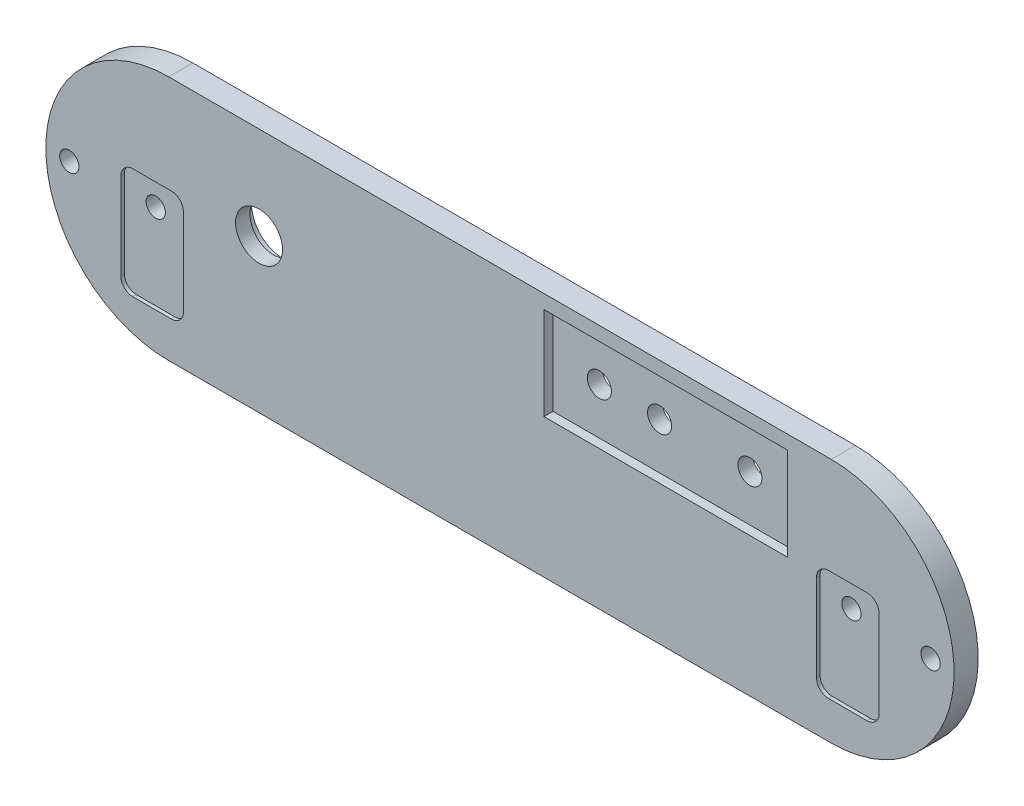
from build123d import *

# Parameters (mm, degrees)
BOSS_EXTRU_1_DEPTH      = 4
ESQUISSE6_R             = 1.6
ENL_V_MAT_EXTRU_3_DEPTH = 79.213298102
ENL_V_MAT_EXTRU_4_DEPTH = 0.6
ESQUISSE8_W             = 40.4
ESQUISSE8_H             = 15.4
ENL_V_MAT_EXTRU_5_DEPTH = 1.5
ESQUISSE8_3_R           = 2
ENL_V_MAT_EXTRU_6_DEPTH = 79.213298102
ESQUISSE9_R             = 5.25
ENL_V_MAT_EXTRU_7_DEPTH = 1.6
ESQUISSE9_3_R           = 3.9
ENL_V_MAT_EXTRU_8_DEPTH = 79.213298102
ENL_V_MAT_EXTRU_9_DEPTH = 0.8


with BuildPart() as part:
    # Esquisse1 → Boss.-Extru.1 (new body)
    with BuildSketch(Plane.XY):
        with BuildLine():
            Line((-55, 20.4), (55, 20.4))
            ThreePointArc((55, 20.4), (75.4, 0), (55, -20.4))
            Line((55, -20.4), (-55, -20.4))
            ThreePointArc((-55, -20.4), (-75.4, 0), (-55, 20.4))
        make_face()
    extrude(amount=BOSS_EXTRU_1_DEPTH)

    # Esquisse6 → Enlèv. mat.-Extru.3 (cut, through all)
    with BuildSketch(Plane.XY.offset(4)):
        with Locations((-57.75, 0)):
            Circle(ESQUISSE6_R)
        with Locations((57.75, 0)):
            Circle(ESQUISSE6_R)
        with Locations((71.5, 0)):
            Circle(ESQUISSE6_R)
        with Locations((-71.5, 0)):
            Circle(ESQUISSE6_R)
    extrude(amount=-ENL_V_MAT_EXTRU_3_DEPTH, mode=Mode.SUBTRACT)

    # Esquisse7 → Enlèv. mat.-Extru.4 (cut)
    with BuildSketch(Plane.XY.offset(4)):
        with BuildLine():
            Line((-60.95, 4.2), (-54.55, 4.2))
            ThreePointArc((-54.55, 4.2), (-53.135786438, 3.614213562), (-52.55, 2.2))
            Line((-52.55, 2.2), (-52.55, -12.2))
            ThreePointArc((-52.55, -12.2), (-53.135786438, -13.614213562), (-54.55, -14.2))
            Line((-54.55, -14.2), (-60.95, -14.2))
            ThreePointArc((-60.95, -14.2), (-62.364213562, -13.614213562), (-62.95, -12.2))
            Line((-62.95, -12.2), (-62.95, 2.2))
            ThreePointArc((-62.95, 2.2), (-62.364213562, 3.614213562), (-60.95, 4.2))
        make_face()
        with BuildLine():
            Line((60.95, 4.2), (54.55, 4.2))
            ThreePointArc((54.55, 4.2), (53.135786438, 3.614213562), (52.55, 2.2))
            Line((52.55, 2.2), (52.55, -12.2))
            ThreePointArc((52.55, -12.2), (53.135786438, -13.614213562), (54.55, -14.2))
            Line((54.55, -14.2), (60.95, -14.2))
            ThreePointArc((60.95, -14.2), (62.364213562, -13.614213562), (62.95, -12.2))
            Line((62.95, -12.2), (62.95, 2.2))
            ThreePointArc((62.95, 2.2), (62.364213562, 3.614213562), (60.95, 4.2))
        make_face()
    extrude(amount=-ENL_V_MAT_EXTRU_4_DEPTH, mode=Mode.SUBTRACT)

    # Esquisse8 → Enlèv. mat.-Extru.5 (cut)
    with BuildSketch(Plane.XY.offset(4)):
        with Locations((27.5, 10.4)):
            Rectangle(ESQUISSE8_W, ESQUISSE8_H)
    extrude(amount=-ENL_V_MAT_EXTRU_5_DEPTH, mode=Mode.SUBTRACT)

    # Esquisse8<3> → Enlèv. mat.-Extru.6 (cut, through all)
    with BuildSketch(Plane.XY.offset(4)):
        with Locations((25, 10.4)):
            Circle(ESQUISSE8_3_R)
        with Locations((15, 10.4)):
            Circle(ESQUISSE8_3_R)
        with Locations((40, 10.4)):
            Circle(ESQUISSE8_3_R)
    extrude(amount=-ENL_V_MAT_EXTRU_6_DEPTH, mode=Mode.SUBTRACT)

    # Esquisse9 → Enlèv. mat.-Extru.7 (cut)
    with BuildSketch(Plane(origin=(0, 0, 0), x_dir=(-1, 0, 0), z_dir=(0, 0, -1))):
        with Locations((40, 5)):
            Circle(ESQUISSE9_R)
    extrude(amount=-ENL_V_MAT_EXTRU_7_DEPTH, mode=Mode.SUBTRACT)

    # Esquisse9<3> → Enlèv. mat.-Extru.8 (cut, through all)
    with BuildSketch(Plane(origin=(0, 0, 0), x_dir=(-1, 0, 0), z_dir=(0, 0, -1))):
        with Locations((40, 5)):
            Circle(ESQUISSE9_3_R)
    extrude(amount=-ENL_V_MAT_EXTRU_8_DEPTH, mode=Mode.SUBTRACT)

    # Esquisse10 → Enlèv. mat.-Extru.9 (cut)
    # profile 1 of 24: a face of its own
    with BuildSketch(Plane(origin=(0, 0, 0), x_dir=(-1, 0, 0), z_dir=(0, 0, -1))):
        Polygon((-7.488648481, 5.760557012), (-8.969364037, 4.279841456), (-10.748001341, 6.05847876), (-11.935241742, 6.054032167), (-13.415957298, 4.573316611), (-12.824560394, 3.981919707), (-11.343844838, 5.462635263), (-9.565207534, 3.683997959), (-11.04592309, 2.203282403), (-10.454526186, 1.611885499), (-6.897251577, 5.169160108), align=None)
    # profile 2 of 24: a face of its own
    with BuildSketch(Plane(origin=(0, 0, 0), x_dir=(-1, 0, 0), z_dir=(0, 0, -1))):
        with BuildLine():
            add(Edge.make_bspline(
                [(-4.333511639, 2.605420169), (-4.395801516, 2.664370533), (-4.518579187, 2.780565791), (-4.720441779, 2.929233561), (-4.929305204, 3.057152317), (-5.148225769, 3.160758872), (-5.376591038, 3.239741397), (-5.613852534, 3.296543436), (-5.860218715, 3.330129513), (-6.027580235, 3.332739717), (-6.112291092, 3.334060885)],
                knots=[0, 0, 0, 0, 1.040882578, 2.051651826, 3.038415913, 4.012224473, 4.98727928, 5.968271899, 6.971630815, 8, 8, 8, 8], degree=3))
            add(Edge.make_bspline(
                [(-6.112291092, 3.334060885), (-6.19762286, 3.332106965), (-6.365937526, 3.328252909), (-6.613593771, 3.293356161), (-6.852003627, 3.237882317), (-7.079821121, 3.15646041), (-7.298854176, 3.054506325), (-7.507825264, 2.928024444), (-7.707240779, 2.7786502), (-7.829149413, 2.6635903), (-7.890857322, 2.605349095)],
                knots=[0, 0, 0, 0, 1.036475983, 2.044421605, 3.033015538, 4.006241789, 4.978909718, 5.964201219, 6.969516094, 8, 8, 8, 8], degree=3))
            add(Edge.make_bspline(
                [(-7.890857322, 2.605349095), (-7.949486002, 2.543399758), (-8.065190747, 2.42114164), (-8.214005944, 2.220309132), (-8.342015139, 2.011832276), (-8.44394129, 1.79222433), (-8.524911413, 1.564282733), (-8.580672833, 1.326286966), (-8.615803142, 1.079541473), (-8.618905897, 0.911813835), (-8.620478865, 0.826782865)],
                knots=[0, 0, 0, 0, 1.035370356, 2.043321829, 3.030216223, 4.002584397, 4.978984985, 5.963690331, 6.967675283, 8, 8, 8, 8], degree=3))
            add(Edge.make_bspline(
                [(-8.620478865, 0.826782865), (-8.618921942, 0.741446512), (-8.615856218, 0.573411392), (-8.580631551, 0.326384573), (-8.525128124, 0.088594959), (-8.443497313, -0.139081154), (-8.342305957, -0.359007033), (-8.213965693, -0.567635283), (-8.065201221, -0.768490313), (-7.949489525, -0.890745345), (-7.890857322, -0.952693118)],
                knots=[0, 0, 0, 0, 1.03554716, 2.03908753, 3.023356833, 3.99585233, 4.971125606, 5.957582987, 6.965088123, 8, 8, 8, 8], degree=3))
            add(Edge.make_bspline(
                [(-7.890857322, -0.952693118), (-7.828890959, -1.011291623), (-7.70659924, -1.126936815), (-7.50613813, -1.276092664), (-7.296794088, -1.402505257), (-7.078441273, -1.506104127), (-6.85021501, -1.585654207), (-6.612734805, -1.641673347), (-6.365650692, -1.676752003), (-6.197623445, -1.679837794), (-6.112291092, -1.681404908)],
                knots=[0, 0, 0, 0, 1.035545361, 2.043667206, 3.02882155, 4.002923329, 4.974792527, 5.959664315, 6.963818967, 8, 8, 8, 8], degree=3))
            add(Edge.make_bspline(
                [(-6.112291092, -1.681404908), (-6.026981179, -1.680394625), (-5.858756481, -1.678402423), (-5.611162229, -1.645738292), (-5.373066837, -1.589705576), (-5.143652097, -1.512261536), (-4.924995082, -1.407529232), (-4.714611576, -1.281986806), (-4.514313349, -1.131100231), (-4.391495604, -1.015161249), (-4.329176099, -0.956332128)],
                knots=[0, 0, 0, 0, 1.033605604, 2.038192105, 3.020018283, 3.995463696, 4.967390178, 5.953495233, 6.96157381, 8, 8, 8, 8], degree=3))
            add(Edge.make_bspline(
                [(-4.329176099, -0.956332128), (-4.270542293, -0.894705313), (-4.154969687, -0.773233215), (-4.006382942, -0.573281028), (-3.881179651, -0.363605092), (-3.777272612, -0.145021817), (-3.699300004, 0.084539031), (-3.642496042, 0.322888269), (-3.608875514, 0.571685216), (-3.606314036, 0.7408598), (-3.605013072, 0.826782865)],
                knots=[0, 0, 0, 0, 1.03108762, 2.032368184, 3.013975279, 3.9897687, 4.962277092, 5.949074184, 6.95834334, 8, 8, 8, 8], degree=3))
            add(Edge.make_bspline(
                [(-3.605013072, 0.826782865), (-3.606595275, 0.911810285), (-3.609716246, 1.07953092), (-3.644713654, 1.326327504), (-3.700943381, 1.564036757), (-3.780096601, 1.792706413), (-3.883938262, 2.011277044), (-4.010318301, 2.220632324), (-4.159482991, 2.421090382), (-4.275126971, 2.54338252), (-4.333511639, 2.605420169)],
                knots=[0, 0, 0, 0, 1.03252536, 2.036705445, 3.021602178, 3.996975283, 4.971101734, 5.956281031, 6.96442841, 8, 8, 8, 8], degree=3))
        make_face()
        with BuildLine():
            add(Edge.make_bspline(
                [(-4.929355136, 2.009576672), (-4.890388331, 1.968419852), (-4.813575469, 1.887289945), (-4.714264897, 1.754386386), (-4.630131699, 1.615762744), (-4.561046189, 1.470424314), (-4.507509614, 1.318553365), (-4.469179147, 1.160077314), (-4.446045244, 0.995464392), (-4.442748538, 0.883564935), (-4.441075663, 0.826782865)],
                knots=[0, 0, 0, 0, 1.034154483, 2.038565042, 3.022343384, 3.990746911, 4.971435185, 5.957159338, 6.963384414, 8, 8, 8, 8], degree=3))
            add(Edge.make_bspline(
                [(-4.441075663, 0.826782865), (-4.442762719, 0.770001728), (-4.4460963, 0.657803685), (-4.469116625, 0.492882647), (-4.507299176, 0.334323986), (-4.56149176, 0.182722563), (-4.629838311, 0.037058206), (-4.714318424, -0.10170021), (-4.813531812, -0.234708633), (-4.890537942, -0.315705407), (-4.929612781, -0.356805199)],
                knots=[0, 0, 0, 0, 1.035863614, 2.046839418, 3.031848518, 4.00661017, 4.979312524, 5.962377223, 6.966059173, 8, 8, 8, 8], degree=3))
            add(Edge.make_bspline(
                [(-4.929612781, -0.356805199), (-4.970469296, -0.395791088), (-5.051101359, -0.47273139), (-5.182675476, -0.573428284), (-5.321946664, -0.65724007), (-5.467467175, -0.726987924), (-5.620087016, -0.781975364), (-5.7798986, -0.820763846), (-5.946270503, -0.84517901), (-6.059440762, -0.848305399), (-6.116839855, -0.84989108)],
                knots=[0, 0, 0, 0, 1.025546179, 2.023958797, 3.002904201, 3.973894049, 4.951613763, 5.944507637, 6.95746995, 8, 8, 8, 8], degree=3))
            add(Edge.make_bspline(
                [(-6.116839855, -0.84989108), (-6.173636741, -0.848326329), (-6.285307707, -0.845249799), (-6.449527942, -0.820638036), (-6.607286363, -0.782049767), (-6.75845289, -0.726533401), (-6.90342067, -0.657550309), (-7.04202192, -0.573115093), (-7.173504572, -0.472771847), (-7.254120874, -0.395804694), (-7.294969404, -0.356805199)],
                knots=[0, 0, 0, 0, 1.038420532, 2.041686296, 3.030450046, 4.004274774, 4.981757309, 5.96250766, 6.967596333, 8, 8, 8, 8], degree=3))
            add(Edge.make_bspline(
                [(-7.294969404, -0.356805199), (-7.334358802, -0.315718336), (-7.411973648, -0.234758718), (-7.511976361, -0.101482063), (-7.598320934, 0.036980975), (-7.66867125, 0.182473533), (-7.723668312, 0.334291485), (-7.762461174, 0.492917943), (-7.78789689, 0.657671824), (-7.791627176, 0.769981356), (-7.793513799, 0.826782865)],
                knots=[0, 0, 0, 0, 1.034748449, 2.038920251, 3.024967065, 3.999680523, 4.973550384, 5.957093399, 6.966782462, 8, 8, 8, 8], degree=3))
            add(Edge.make_bspline(
                [(-7.793513799, 0.826782865), (-7.791642593, 0.883585639), (-7.787952673, 0.995597685), (-7.762394305, 1.16004067), (-7.723456406, 1.318583639), (-7.669122376, 1.470679605), (-7.598026509, 1.615837419), (-7.512017401, 1.754157025), (-7.411962942, 1.887409743), (-7.334355198, 1.968372646), (-7.294969404, 2.009461176)],
                knots=[0, 0, 0, 0, 1.033893284, 2.038782502, 3.022968775, 4.002669564, 4.973054543, 5.959746252, 6.964574803, 8, 8, 8, 8], degree=3))
            add(Edge.make_bspline(
                [(-7.294969404, 2.009461176), (-7.254117003, 2.048452149), (-7.173493061, 2.125402485), (-7.042066096, 2.22586832), (-6.903146921, 2.309919788), (-6.758904884, 2.380573055), (-6.60704483, 2.434362429), (-6.449566514, 2.473394306), (-6.285297608, 2.497879518), (-6.173633336, 2.500973453), (-6.116839855, 2.502547057)],
                knots=[0, 0, 0, 0, 1.032336146, 2.037359086, 3.018045294, 3.997868532, 4.969748149, 5.958447233, 6.961647382, 8, 8, 8, 8], degree=3))
            add(Edge.make_bspline(
                [(-6.116839855, 2.502547057), (-6.05944416, 2.500952465), (-5.946280601, 2.497808507), (-5.779859865, 2.473521406), (-5.620327221, 2.434285206), (-5.467016844, 2.38102873), (-5.322220642, 2.309608613), (-5.182631484, 2.226181272), (-5.051112799, 2.12536214), (-4.970473143, 2.048438581), (-4.929355136, 2.009576672)],
                knots=[0, 0, 0, 0, 1.042459734, 2.055353725, 3.04818063, 4.023985327, 4.997298338, 5.976177714, 6.974522992, 8, 8, 8, 8], degree=3))
        make_face(mode=Mode.SUBTRACT)
    # profile 3 of 24: a face of its own
    with BuildSketch(Plane(origin=(0, 0, 0), x_dir=(-1, 0, 0), z_dir=(0, 0, -1))):
        with BuildLine():
            add(Edge.make_bspline(
                [(-1.413408834, -4.467800741), (-1.444364247, -4.496429084), (-1.505258253, -4.552745388), (-1.60430696, -4.626148752), (-1.708753465, -4.687440378), (-1.818266046, -4.737462427), (-1.932391774, -4.777074102), (-2.051710821, -4.804068541), (-2.175670497, -4.820916952), (-2.260100956, -4.82291842), (-2.302914056, -4.823933326)],
                knots=[0, 0, 0, 0, 1.027936133, 2.022106722, 3.000214623, 3.976642886, 4.95444307, 5.941322166, 6.956083143, 8, 8, 8, 8], degree=3))
            add(Edge.make_bspline(
                [(-2.302914056, -4.823933326), (-2.345739389, -4.823019967), (-2.429934363, -4.821224294), (-2.553533594, -4.802995306), (-2.672584457, -4.775286663), (-2.786653053, -4.734649653), (-2.896480544, -4.683947877), (-3.00075012, -4.620313375), (-3.10043631, -4.545666176), (-3.161634276, -4.488232448), (-3.192652048, -4.459122555)],
                knots=[0, 0, 0, 0, 1.039723389, 2.044105151, 3.02870267, 4.00499634, 4.980594832, 5.962321637, 6.967216646, 8, 8, 8, 8], degree=3))
            add(Edge.make_bspline(
                [(-3.192652048, -4.459122555), (-3.222484487, -4.428205761), (-3.281067165, -4.36749371), (-3.355502271, -4.266912596), (-3.420239584, -4.163032305), (-3.471924753, -4.052903056), (-3.513556981, -3.938299675), (-3.541015079, -3.818157732), (-3.559316722, -3.693676441), (-3.561103055, -3.608875316), (-3.562011582, -3.565745554)],
                knots=[0, 0, 0, 0, 1.036483605, 2.035367747, 3.015034268, 3.987916637, 4.967720004, 5.953552987, 6.959179192, 8, 8, 8, 8], degree=3))
            add(Edge.make_bspline(
                [(-3.562011582, -3.565745554), (-3.560658002, -3.524144829), (-3.55797875, -3.441801128), (-3.540605676, -3.320704228), (-3.511257488, -3.20395178), (-3.470080364, -3.091899012), (-3.418024133, -2.983983886), (-3.354506144, -2.880526375), (-3.280371721, -2.780741642), (-3.222153094, -2.72028763), (-3.192652048, -2.689653851)],
                knots=[0, 0, 0, 0, 1.022348484, 2.023617618, 2.99969055, 3.975791933, 4.952433738, 5.93917476, 6.955720822, 8, 8, 8, 8], degree=3))
            Line((-3.192652048, -2.689653851), (-1.115487085, -0.612604384))
            Line((-1.115487085, -0.612604384), (-1.706883989, -0.02120748))
            Line((-1.706883989, -0.02120748), (-3.783443042, -2.097766533))
            add(Edge.make_bspline(
                [(-3.783443042, -2.097766533), (-3.832623014, -2.149164897), (-3.929429492, -2.250338085), (-4.054268387, -2.416581891), (-4.160775999, -2.590022881), (-4.2472807, -2.772298524), (-4.316508619, -2.962128577), (-4.363761185, -3.160640301), (-4.395254936, -3.366730016), (-4.399536073, -3.507099308), (-4.401713183, -3.578482089)],
                knots=[0, 0, 0, 0, 1.035059192, 2.03742358, 3.020401311, 3.994111759, 4.970451876, 5.95681568, 6.960968062, 8, 8, 8, 8], degree=3))
            add(Edge.make_bspline(
                [(-4.401713183, -3.578482089), (-4.399772244, -3.649543513), (-4.395940113, -3.789845021), (-4.366109929, -3.995868615), (-4.317992701, -4.193729315), (-4.250102863, -4.383290234), (-4.163538556, -4.564672818), (-4.057781743, -4.738059075), (-3.933448817, -4.903326685), (-3.837202069, -5.004073267), (-3.788539966, -5.055010473)],
                knots=[0, 0, 0, 0, 1.037893928, 2.049186116, 3.034573046, 4.008538879, 4.985533254, 5.965737081, 6.971482034, 8, 8, 8, 8], degree=3))
            add(Edge.make_bspline(
                [(-3.788539966, -5.055010473), (-3.737318807, -5.104002819), (-3.636313618, -5.200612917), (-3.470256045, -5.325253433), (-3.296659769, -5.432064302), (-3.114083107, -5.5179346), (-2.924361648, -5.587453905), (-2.72606126, -5.636061481), (-2.519491101, -5.667046676), (-2.378837536, -5.671421964), (-2.307462819, -5.673642206)],
                knots=[0, 0, 0, 0, 1.031106455, 2.033282831, 3.016076187, 3.993589973, 4.965595018, 5.952830613, 6.961162951, 8, 8, 8, 8], degree=3))
            add(Edge.make_bspline(
                [(-2.307462819, -5.673642206), (-2.236113129, -5.67197092), (-2.09526586, -5.668671731), (-1.888143241, -5.640216196), (-1.689480096, -5.59120661), (-1.498387082, -5.525412402), (-1.315915593, -5.437866483), (-1.142304454, -5.33094491), (-0.975530848, -5.205818508), (-0.874256823, -5.108869566), (-0.822746662, -5.059559236)],
                knots=[0, 0, 0, 0, 1.036435881, 2.045967707, 3.030258216, 4.005751042, 4.977414793, 5.9643844, 6.964641861, 8, 8, 8, 8], degree=3))
            Line((-0.822746662, -5.059559236), (-1.413408834, -4.467800741))
        make_face()
    # profile 4 of 24: a face of its own
    with BuildSketch(Plane(origin=(0, 0, 0), x_dir=(-1, 0, 0), z_dir=(0, 0, -1))):
        with BuildLine():
            add(Edge.make_bspline(
                [(2.555295724, -7.991845973), (2.597013205, -7.983740192), (2.68001296, -7.967613192), (2.800825198, -7.931393077), (2.91833428, -7.888055312), (3.030601371, -7.834116281), (3.13922869, -7.771977751), (3.242393419, -7.699713309), (3.342493822, -7.619869439), (3.403994711, -7.559949805), (3.435050425, -7.529692567)],
                knots=[0, 0, 0, 0, 1.008939386, 2.007353233, 2.99210853, 3.981306493, 4.962366239, 5.961481484, 6.970622238, 8, 8, 8, 8], degree=3))
            add(Edge.make_bspline(
                [(3.435050425, -7.529692567), (3.473758847, -7.488847043), (3.550162476, -7.408225149), (3.649725581, -7.27632183), (3.733856584, -7.137612286), (3.802333886, -6.992010061), (3.856246364, -6.840247365), (3.895554003, -6.681890004), (3.919749342, -6.516668286), (3.922899484, -6.404107306), (3.924497295, -6.347014256)],
                knots=[0, 0, 0, 0, 1.026716488, 2.026558081, 3.010190258, 3.983454108, 4.958778445, 5.945676909, 6.95800863, 8, 8, 8, 8], degree=3))
            add(Edge.make_bspline(
                [(3.924497295, -6.347014256), (3.922808421, -6.290234003), (3.919471249, -6.178037707), (3.89647714, -6.013103916), (3.85819826, -5.854592116), (3.804316314, -5.702695544), (3.734572538, -5.557564712), (3.650706073, -5.418582237), (3.550796586, -5.286377563), (3.474068673, -5.205476404), (3.435050425, -5.164335944)],
                knots=[0, 0, 0, 0, 1.036128329, 2.047362487, 3.032623305, 4.007634057, 4.982958903, 5.966274823, 6.96579495, 8, 8, 8, 8], degree=3))
            Line((3.435050425, -5.164335944), (1.874966955, -3.603058424))
            Line((1.874966955, -3.603058424), (1.652637292, -4.439017957))
            Line((1.652637292, -4.439017957), (1.652637292, -4.572415755))
            Line((1.652637292, -4.572415755), (2.839877693, -5.759656156))
            add(Edge.make_bspline(
                [(2.839877693, -5.759656156), (2.85875037, -5.780194112), (2.895929979, -5.82065436), (2.945716274, -5.885350478), (2.986749077, -5.954243736), (3.020673615, -6.026445202), (3.046896593, -6.102122082), (3.066397809, -6.180912032), (3.077231317, -6.263011678), (3.078629422, -6.318781933), (3.079337179, -6.347014256)],
                knots=[0, 0, 0, 0, 1.027198458, 2.023604677, 3.000599963, 3.975037666, 4.957128138, 5.945992383, 6.960209047, 8, 8, 8, 8], degree=3))
            add(Edge.make_bspline(
                [(3.079337179, -6.347014256), (3.078944103, -6.375848421), (3.078171949, -6.432489877), (3.068189583, -6.51577911), (3.049789157, -6.595240077), (3.024295115, -6.671168215), (2.991205224, -6.743798546), (2.950458165, -6.813032396), (2.900621259, -6.878081902), (2.862877024, -6.918055587), (2.843711269, -6.938353412)],
                knots=[0, 0, 0, 0, 1.056173246, 2.074732872, 3.066699434, 4.040068899, 5.004773559, 5.986228257, 6.977447667, 8, 8, 8, 8], degree=3))
            add(Edge.make_bspline(
                [(2.843711269, -6.938353412), (2.822799817, -6.958112407), (2.781603462, -6.997038379), (2.715184619, -7.048602318), (2.644398802, -7.090237679), (2.570903673, -7.125406082), (2.493895577, -7.15294384), (2.412835753, -7.170618246), (2.329133557, -7.182213246), (2.272123713, -7.182786672), (2.243274588, -7.183076847)],
                knots=[0, 0, 0, 0, 1.034712477, 2.038422923, 3.016916518, 3.983109225, 4.966455886, 5.950951636, 6.963104461, 8, 8, 8, 8], degree=3))
            add(Edge.make_bspline(
                [(2.243274588, -7.183076847), (2.215020687, -7.182502271), (2.159166052, -7.181366401), (2.077406463, -7.168609075), (1.998215522, -7.151030684), (1.922780762, -7.124227228), (1.85016079, -7.09075158), (1.782237713, -7.04823368), (1.71641041, -6.999984707), (1.676710279, -6.962168469), (1.656484195, -6.942902174)],
                knots=[0, 0, 0, 0, 1.039956984, 2.055872488, 3.042304158, 4.024551448, 4.999144746, 5.98209067, 6.971932768, 8, 8, 8, 8], degree=3))
            Line((1.656484195, -6.942902174), (1.13238588, -6.408858772))
            Line((1.13238588, -6.408858772), (0.380911619, -9.223552306))
            Line((0.380911619, -9.223552306), (1.061240388, -9.903881075))
            Line((1.061240388, -9.903881075), (1.608171359, -7.898467515))
            add(Edge.make_bspline(
                [(1.608171359, -7.898467515), (1.644671801, -7.913238551), (1.717836953, -7.9428471), (1.831298497, -7.975827205), (1.946859834, -8.000572522), (2.064491799, -8.017135992), (2.184354261, -8.0243825), (2.306219667, -8.022055305), (2.430054569, -8.012731808), (2.512644542, -7.998861181), (2.555295724, -7.991845973)],
                knots=[0, 0, 0, 0, 0.978951846, 1.96230943, 2.93434712, 3.916865303, 4.914413153, 5.917790757, 6.94703516, 8, 8, 8, 8], degree=3))
        make_face()
    # profile 5 of 24: a face of its own
    with BuildSketch(Plane(origin=(0, 0, 0), x_dir=(-1, 0, 0), z_dir=(0, 0, -1))):
        with BuildLine():
            add(Edge.make_bspline(
                [(5.218845734, -11.100055309), (5.246922359, -11.131504988), (5.302101014, -11.193312665), (5.359962122, -11.303462293), (5.395093527, -11.423393597), (5.398814129, -11.506878842), (5.400717173, -11.549580567)],
                knots=[0, 0, 0, 0, 1.013244372, 1.991317005, 2.972582172, 4, 4, 4, 4], degree=3))
            add(Edge.make_bspline(
                [(5.400717173, -11.549580567), (5.398502333, -11.591999824), (5.394188888, -11.674612165), (5.358587839, -11.792797395), (5.30320385, -11.901913756), (5.249600215, -11.963304444), (5.222405674, -11.994449563)],
                knots=[0, 0, 0, 0, 1.034688485, 2.015076295, 2.99299574, 4, 4, 4, 4], degree=3))
            add(Edge.make_bspline(
                [(5.222405674, -11.994449563), (5.19051, -12.022899047), (5.12775619, -12.078872581), (5.051546957, -12.114367946), (5.01407234, -12.131822198)],
                knots=[0, 0, 0, 0, 1.016533444, 2, 2, 2, 2], degree=3))
            add(Edge.make_bspline(
                [(5.01407234, -12.131822198), (4.975118925, -12.146842549), (4.899224916, -12.176107112), (4.817987748, -12.179363718), (4.778446431, -12.180948835)],
                knots=[0, 0, 0, 0, 1.026521505, 2, 2, 2, 2], degree=3))
            add(Edge.make_bspline(
                [(4.778446431, -12.180948835), (4.737975343, -12.178400467), (4.655116785, -12.17318306), (4.577816047, -12.142810797), (4.538271758, -12.127273435)],
                knots=[0, 0, 0, 0, 0.976871636, 2, 2, 2, 2], degree=3))
            add(Edge.make_bspline(
                [(4.538271758, -12.127273435), (4.501346758, -12.109215814), (4.425922027, -12.072330474), (4.364784446, -12.014745606), (4.333577435, -11.985352038)],
                knots=[0, 0, 0, 0, 0.97912182, 2, 2, 2, 2], degree=3))
            Line((4.333577435, -11.985352038), (3.738130178, -12.580770865))
            add(Edge.make_bspline(
                [(3.738130178, -12.580770865), (3.774341434, -12.615314232), (3.84581379, -12.683494574), (3.962714882, -12.771900455), (4.085607598, -12.845919692), (4.213131097, -12.907203226), (4.346018201, -12.954949929), (4.484149865, -12.98848109), (4.627407934, -13.009098512), (4.724701938, -13.011332879), (4.773897668, -13.012462664)],
                knots=[0, 0, 0, 0, 1.040966667, 2.054619122, 3.042880472, 4.022477668, 4.994727475, 5.975970251, 6.976569824, 8, 8, 8, 8], degree=3))
            add(Edge.make_bspline(
                [(4.773897668, -13.012462664), (4.82400194, -13.01134126), (4.922804693, -13.009129918), (5.0681894, -12.988521994), (5.20769615, -12.954893197), (5.34162275, -12.908279966), (5.469570701, -12.848168707), (5.590874585, -12.773482955), (5.707659157, -12.687166709), (5.778627641, -12.619924186), (5.814654582, -12.585788719)],
                knots=[0, 0, 0, 0, 1.040015934, 2.050851812, 3.042137188, 4.016047416, 4.990751368, 5.971418109, 6.970196421, 8, 8, 8, 8], degree=3))
            add(Edge.make_bspline(
                [(5.814654582, -12.585788719), (5.848813229, -12.550090383), (5.916251719, -12.47961213), (6.002615495, -12.36276723), (6.076774417, -12.240853813), (6.137202005, -12.11278374), (6.18358562, -11.979087171), (6.217518753, -11.839963403), (6.238015349, -11.694541748), (6.240211511, -11.595438077), (6.241328527, -11.545031805)],
                knots=[0, 0, 0, 0, 1.025036645, 2.023701998, 3.009641162, 3.984234879, 4.95803496, 5.943089008, 6.953810564, 8, 8, 8, 8], degree=3))
            add(Edge.make_bspline(
                [(6.241328527, -11.545031805), (6.240198728, -11.495836088), (6.237964333, -11.39854211), (6.217347116, -11.255283853), (6.183815195, -11.117152883), (6.136071304, -10.98426321), (6.074777184, -10.856749383), (6.0007982, -10.733819886), (5.912234893, -10.617058642), (5.844449891, -10.545221029), (5.810105819, -10.508823653)],
                knots=[0, 0, 0, 0, 1.023422299, 2.02401417, 3.005249393, 3.977491717, 4.957081372, 5.945335116, 6.958979769, 8, 8, 8, 8], degree=3))
            Line((5.810105819, -10.508823653), (4.925370579, -9.623786346))
            add(Edge.make_bspline(
                [(4.925370579, -9.623786346), (4.896164962, -9.59176686), (4.839157456, -9.529266859), (4.779170969, -9.417869743), (4.742808572, -9.297205126), (4.73989862, -9.213292899), (4.738417318, -9.170577656)],
                knots=[0, 0, 0, 0, 1.028627869, 2.007816146, 2.98588538, 4, 4, 4, 4], degree=3))
            add(Edge.make_bspline(
                [(4.738417318, -9.170577656), (4.741113921, -9.128993288), (4.746421948, -9.047138073), (4.786460911, -8.930953052), (4.844410769, -8.821897943), (4.900660165, -8.761293051), (4.929465353, -8.730257423)],
                knots=[0, 0, 0, 0, 1.0118946, 1.991826536, 2.971618926, 4, 4, 4, 4], degree=3))
            add(Edge.make_bspline(
                [(4.929465353, -8.730257423), (4.959535014, -8.702174986), (5.019347513, -8.646315334), (5.092990578, -8.610629974), (5.129610914, -8.592884789)],
                knots=[0, 0, 0, 0, 1.005464112, 2, 2, 2, 2], degree=3))
            add(Edge.make_bspline(
                [(5.129610914, -8.592884789), (5.1680182, -8.578785307), (5.24415731, -8.550834307), (5.325116393, -8.546102878), (5.365236824, -8.543758151)],
                knots=[0, 0, 0, 0, 1.008871415, 2, 2, 2, 2], degree=3))
            add(Edge.make_bspline(
                [(5.365236824, -8.543758151), (5.38648105, -8.544320415), (5.428523404, -8.545433137), (5.491307423, -8.553228125), (5.551829207, -8.569891285), (5.590679502, -8.585258363), (5.609960259, -8.592884789)],
                knots=[0, 0, 0, 0, 1.014009251, 2.006725693, 3.010771049, 4, 4, 4, 4], degree=3))
            add(Edge.make_bspline(
                [(5.609960259, -8.592884789), (5.646885259, -8.610942409), (5.72230999, -8.647827749), (5.783447571, -8.705412618), (5.814654582, -8.734806186)],
                knots=[0, 0, 0, 0, 0.97912182, 2, 2, 2, 2], degree=3))
            Line((5.814654582, -8.734806186), (6.410532728, -8.138624197))
            add(Edge.make_bspline(
                [(6.410532728, -8.138624197), (6.373790438, -8.10442579), (6.301383783, -8.037032268), (6.184646907, -7.948236041), (6.061907705, -7.874137036), (5.933902237, -7.813670424), (5.80059384, -7.767195002), (5.661937481, -7.734276944), (5.517736446, -7.71469079), (5.419579948, -7.713067706), (5.369785586, -7.712244323)],
                knots=[0, 0, 0, 0, 1.041589271, 2.052621016, 3.038327303, 4.012690823, 4.986260894, 5.963487657, 6.966886192, 8, 8, 8, 8], degree=3))
            add(Edge.make_bspline(
                [(5.369785586, -7.712244323), (5.320278314, -7.713664031), (5.222334914, -7.71647273), (5.07857511, -7.738139243), (4.940505105, -7.771579208), (4.808120592, -7.818366373), (4.681513724, -7.878785757), (4.559884711, -7.951670353), (4.444534518, -8.038579894), (4.373913052, -8.105172836), (4.338126198, -8.138918268)],
                knots=[0, 0, 0, 0, 1.036094534, 2.049772044, 3.036795931, 4.006662191, 4.983567962, 5.968936574, 6.970775108, 8, 8, 8, 8], degree=3))
            add(Edge.make_bspline(
                [(4.338126198, -8.138918268), (4.303761, -8.175302496), (4.235934301, -8.24711416), (4.147579754, -8.364190575), (4.072419495, -8.48657172), (4.011038231, -8.614605447), (3.963752915, -8.748308494), (3.928937491, -8.887136111), (3.907735903, -9.031656388), (3.904165287, -9.12987252), (3.902354728, -9.179675182)],
                knots=[0, 0, 0, 0, 1.036197596, 2.045146433, 3.032086528, 4.007138131, 4.980792275, 5.965089527, 6.968153629, 8, 8, 8, 8], degree=3))
            add(Edge.make_bspline(
                [(3.902354728, -9.179675182), (3.903484527, -9.228870898), (3.905718921, -9.326164877), (3.926336138, -9.469423134), (3.959868059, -9.607554103), (4.00761195, -9.740443776), (4.06890607, -9.867957604), (4.142885054, -9.9908871), (4.231448361, -10.107648344), (4.299233363, -10.179485958), (4.333577435, -10.215883333)],
                knots=[0, 0, 0, 0, 1.023422299, 2.02401417, 3.005249393, 3.977491717, 4.957081372, 5.945335116, 6.958979769, 8, 8, 8, 8], degree=3))
            Line((4.333577435, -10.215883333), (5.218845734, -11.100055309))
        make_face()
    # profile 6 of 24: a face of its own
    with BuildSketch(Plane(origin=(0, 0, 0), x_dir=(-1, 0, 0), z_dir=(0, 0, -1))):
        Polygon((-20.685749036, 7.303524873), (-20.694642222, 3.728463891), (-18.315714828, 3.724017298), (-20.441186406, 1.598545719), (-19.854236096, 1.011595409), (-16.296961487, 4.568870018), (-19.854236096, 4.568870018), (-19.858682689, 8.13059122), align=None)
    # profile 7 of 24: a face of its own
    with BuildSketch(Plane(origin=(0, 0, 0), x_dir=(-1, 0, 0), z_dir=(0, 0, -1))):
        Polygon((-15.490141842, 2.588149752), (-15.494588436, 3.766496966), (-19.051863044, 0.209222357), (-17.864622644, 0.213668951), align=None)
    # profile 8 of 24: a face of its own
    with BuildSketch(Plane(origin=(0, 0, 0), x_dir=(-1, 0, 0), z_dir=(0, 0, -1))):
        Polygon((-11.152807196, -0.575284273), (-13.282725369, -2.705202445), (-13.518394811, 1.790303342), (-14.41660665, 0.892091503), (-14.118684902, -4.723955786), (-14.114238308, -4.719509192), (-14.109791715, -4.715062599), (-10.561410293, -1.166681177), align=None)
    # profile 9 of 24: a face of its own
    with BuildSketch(Plane(origin=(0, 0, 0), x_dir=(-1, 0, 0), z_dir=(0, 0, -1))):
        with BuildLine():
            add(Edge.make_bspline(
                [(-9.47838591, -6.402823665), (-9.509341323, -6.431452008), (-9.570235329, -6.487768312), (-9.669284036, -6.561171675), (-9.773730541, -6.622463302), (-9.883243122, -6.672485351), (-9.99736885, -6.712097026), (-10.116687897, -6.739091465), (-10.240647573, -6.755939876), (-10.325078033, -6.757941344), (-10.367891133, -6.75895625)],
                knots=[0, 0, 0, 0, 1.027936133, 2.022106722, 3.000214623, 3.976642886, 4.95444307, 5.941322166, 6.956083143, 8, 8, 8, 8], degree=3))
            add(Edge.make_bspline(
                [(-10.367891133, -6.75895625), (-10.410716466, -6.758042891), (-10.49491144, -6.756247218), (-10.618510671, -6.73801823), (-10.737561533, -6.710309587), (-10.851630129, -6.669672577), (-10.96145762, -6.618970801), (-11.065727197, -6.555336298), (-11.165413386, -6.480689099), (-11.226611353, -6.423255371), (-11.257629124, -6.394145479)],
                knots=[0, 0, 0, 0, 1.039723389, 2.044105151, 3.02870267, 4.00499634, 4.980594832, 5.962321637, 6.967216646, 8, 8, 8, 8], degree=3))
            add(Edge.make_bspline(
                [(-11.257629124, -6.394145479), (-11.287461563, -6.363228685), (-11.346044241, -6.302516634), (-11.420479347, -6.20193552), (-11.48521666, -6.098055228), (-11.536901829, -5.98792598), (-11.578534057, -5.873322599), (-11.605992155, -5.753180655), (-11.624293798, -5.628699364), (-11.626080131, -5.54389824), (-11.626988658, -5.500768477)],
                knots=[0, 0, 0, 0, 1.036483605, 2.035367747, 3.015034268, 3.987916637, 4.967720004, 5.953552987, 6.959179192, 8, 8, 8, 8], degree=3))
            add(Edge.make_bspline(
                [(-11.626988658, -5.500768477), (-11.625635078, -5.459167753), (-11.622955826, -5.376824052), (-11.605582752, -5.255727152), (-11.576234564, -5.138974704), (-11.535057441, -5.026921936), (-11.48300121, -4.91900681), (-11.41948322, -4.815549299), (-11.345348797, -4.715764565), (-11.28713017, -4.655310554), (-11.257629124, -4.624676774)],
                knots=[0, 0, 0, 0, 1.022348484, 2.023617618, 2.99969055, 3.975791933, 4.952433738, 5.93917476, 6.955720822, 8, 8, 8, 8], degree=3))
            Line((-11.257629124, -4.624676774), (-9.180464162, -2.547627308))
            Line((-9.180464162, -2.547627308), (-9.771861065, -1.956230404))
            Line((-9.771861065, -1.956230404), (-11.848420118, -4.032789457))
            add(Edge.make_bspline(
                [(-11.848420118, -4.032789457), (-11.89760009, -4.084187821), (-11.994406569, -4.185361009), (-12.119245463, -4.351604815), (-12.225753075, -4.525045805), (-12.312257776, -4.707321447), (-12.381485695, -4.897151501), (-12.428738261, -5.095663225), (-12.460232013, -5.301752939), (-12.464513149, -5.442122232), (-12.466690259, -5.513505013)],
                knots=[0, 0, 0, 0, 1.035059192, 2.03742358, 3.020401311, 3.994111759, 4.970451876, 5.95681568, 6.960968062, 8, 8, 8, 8], degree=3))
            add(Edge.make_bspline(
                [(-12.466690259, -5.513505013), (-12.46474932, -5.584566437), (-12.460917189, -5.724867945), (-12.431087006, -5.930891538), (-12.382969778, -6.128752239), (-12.315079939, -6.318313158), (-12.228515632, -6.499695742), (-12.122758819, -6.673081999), (-11.998425894, -6.838349609), (-11.902179145, -6.939096191), (-11.853517042, -6.990033397)],
                knots=[0, 0, 0, 0, 1.037893928, 2.049186116, 3.034573046, 4.008538879, 4.985533254, 5.965737081, 6.971482034, 8, 8, 8, 8], degree=3))
            add(Edge.make_bspline(
                [(-11.853517042, -6.990033397), (-11.802295883, -7.039025743), (-11.701290694, -7.135635841), (-11.535233121, -7.260276357), (-11.361636845, -7.367087226), (-11.179060183, -7.452957524), (-10.989338725, -7.522476829), (-10.791038336, -7.571084405), (-10.584468177, -7.6020696), (-10.443814612, -7.606444888), (-10.372439895, -7.608665129)],
                knots=[0, 0, 0, 0, 1.031106455, 2.033282831, 3.016076187, 3.993589973, 4.965595018, 5.952830613, 6.961162951, 8, 8, 8, 8], degree=3))
            add(Edge.make_bspline(
                [(-10.372439895, -7.608665129), (-10.301090205, -7.606993843), (-10.160242936, -7.603694655), (-9.953120317, -7.575239119), (-9.754457172, -7.526229534), (-9.563364158, -7.460435326), (-9.38089267, -7.372889407), (-9.20728153, -7.265967833), (-9.040507924, -7.140841431), (-8.939233899, -7.043892489), (-8.887723738, -6.99458216)],
                knots=[0, 0, 0, 0, 1.036435881, 2.045967707, 3.030258216, 4.005751042, 4.977414793, 5.9643844, 6.964641861, 8, 8, 8, 8], degree=3))
            Line((-8.887723738, -6.99458216), (-9.47838591, -6.402823665))
        make_face()
    # profile 10 of 24: a face of its own
    with BuildSketch(Plane(origin=(0, 0, 0), x_dir=(-1, 0, 0), z_dir=(0, 0, -1))):
        Polygon((-6.190010121, -5.538081348), (-6.785853618, -6.133924845), (-9.74728473, -9.095355957), (-9.151441233, -9.691199454), (-6.190010121, -6.729768342), (-5.007216314, -7.91256215), (-4.411372817, -7.316718653), align=None)
    # profile 11 of 24: a face of its own
    with BuildSketch(Plane(origin=(0, 0, 0), x_dir=(-1, 0, 0), z_dir=(0, 0, -1))):
        Polygon((-7.310471575, -11.43434406), (-7.359384101, -11.483256586), (-4.989349893, -13.853290794), (-4.393506396, -13.257447297), (-6.1721437, -11.478809993), align=None)
    # profile 12 of 24: a face of its own
    with BuildSketch(Plane(origin=(0, 0, 0), x_dir=(-1, 0, 0), z_dir=(0, 0, -1))):
        Polygon((-3.802109492, -7.925981978), (-3.806556085, -9.113222378), (-2.027918781, -10.891859683), (-1.432075284, -10.296016186), align=None)
    # profile 13 of 24: a face of its own
    with BuildSketch(Plane(origin=(0, 0, 0), x_dir=(-1, 0, 0), z_dir=(0, 0, -1))):
        Polygon((-5.287271641, -9.411144127), (-5.878668545, -10.00254103), (-5.287271641, -10.593937934), (-3.508634337, -12.372575239), (-2.917237433, -11.781178335), (-4.695874737, -10.00254103), align=None)
    # profile 14 of 24: a face of its own
    with BuildSketch(Plane(origin=(0, 0, 0), x_dir=(-1, 0, 0), z_dir=(0, 0, -1))):
        with BuildLine():
            add(Edge.make_bspline(
                [(-0.99344982, -14.887759756), (-0.965373194, -14.919209435), (-0.91019454, -14.981017112), (-0.852333431, -15.09116674), (-0.817202026, -15.211098043), (-0.813481425, -15.294583289), (-0.811578381, -15.337285014)],
                knots=[0, 0, 0, 0, 1.013244372, 1.991317005, 2.972582172, 4, 4, 4, 4], degree=3))
            add(Edge.make_bspline(
                [(-0.811578381, -15.337285014), (-0.813793221, -15.379704271), (-0.818106665, -15.462316612), (-0.853707714, -15.580501842), (-0.909091703, -15.689618203), (-0.962695339, -15.751008891), (-0.98988988, -15.78215401)],
                knots=[0, 0, 0, 0, 1.034688485, 2.015076295, 2.99299574, 4, 4, 4, 4], degree=3))
            add(Edge.make_bspline(
                [(-0.98988988, -15.78215401), (-1.021785553, -15.810603494), (-1.084539363, -15.866577027), (-1.160748597, -15.902072392), (-1.198223213, -15.919526644)],
                knots=[0, 0, 0, 0, 1.016533444, 2, 2, 2, 2], degree=3))
            add(Edge.make_bspline(
                [(-1.198223213, -15.919526644), (-1.237176629, -15.934546996), (-1.313070637, -15.963811559), (-1.394307805, -15.967068164), (-1.433849123, -15.968653282)],
                knots=[0, 0, 0, 0, 1.026521505, 2, 2, 2, 2], degree=3))
            add(Edge.make_bspline(
                [(-1.433849123, -15.968653282), (-1.474320211, -15.966104913), (-1.557178769, -15.960887506), (-1.634479507, -15.930515243), (-1.674023795, -15.914977882)],
                knots=[0, 0, 0, 0, 0.976871636, 2, 2, 2, 2], degree=3))
            add(Edge.make_bspline(
                [(-1.674023795, -15.914977882), (-1.710948795, -15.896920261), (-1.786373527, -15.860034921), (-1.847511107, -15.802450052), (-1.878718119, -15.773056484)],
                knots=[0, 0, 0, 0, 0.97912182, 2, 2, 2, 2], degree=3))
            Line((-1.878718119, -15.773056484), (-2.474165376, -16.368475311))
            add(Edge.make_bspline(
                [(-2.474165376, -16.368475311), (-2.437954119, -16.403018679), (-2.366481763, -16.471199021), (-2.249580672, -16.559604902), (-2.126687956, -16.633624138), (-1.999164456, -16.694907673), (-1.866277353, -16.742654376), (-1.728145688, -16.776185536), (-1.584887619, -16.796802958), (-1.487593615, -16.799037325), (-1.438397886, -16.80016711)],
                knots=[0, 0, 0, 0, 1.040966667, 2.054619122, 3.042880472, 4.022477668, 4.994727475, 5.975970251, 6.976569824, 8, 8, 8, 8], degree=3))
            add(Edge.make_bspline(
                [(-1.438397886, -16.80016711), (-1.388293613, -16.799045707), (-1.28949086, -16.796834364), (-1.144106153, -16.77622644), (-1.004599403, -16.742597644), (-0.870672803, -16.695984413), (-0.742724853, -16.635873154), (-0.621420968, -16.561187402), (-0.504636396, -16.474871156), (-0.433667912, -16.407628633), (-0.397640972, -16.373493165)],
                knots=[0, 0, 0, 0, 1.040015934, 2.050851812, 3.042137188, 4.016047416, 4.990751368, 5.971418109, 6.970196421, 8, 8, 8, 8], degree=3))
            add(Edge.make_bspline(
                [(-0.397640972, -16.373493165), (-0.363482324, -16.33779483), (-0.296043834, -16.267316576), (-0.209680059, -16.150471677), (-0.135521137, -16.028558259), (-0.075093548, -15.900488186), (-0.028709934, -15.766791618), (0.0052232, -15.62766785), (0.025719795, -15.482246195), (0.027915958, -15.383142523), (0.029032973, -15.332736251)],
                knots=[0, 0, 0, 0, 1.025036645, 2.023701998, 3.009641162, 3.984234879, 4.95803496, 5.943089008, 6.953810564, 8, 8, 8, 8], degree=3))
            add(Edge.make_bspline(
                [(0.029032973, -15.332736251), (0.027903174, -15.283540535), (0.025668779, -15.186246556), (0.005051563, -15.042988299), (-0.028480358, -14.90485733), (-0.076224249, -14.771967657), (-0.137518369, -14.64445383), (-0.211497353, -14.521524333), (-0.300060661, -14.404763089), (-0.367845662, -14.332925475), (-0.402189734, -14.2965281)],
                knots=[0, 0, 0, 0, 1.023422299, 2.02401417, 3.005249393, 3.977491717, 4.957081372, 5.945335116, 6.958979769, 8, 8, 8, 8], degree=3))
            Line((-0.402189734, -14.2965281), (-1.286924975, -13.411490793))
            add(Edge.make_bspline(
                [(-1.286924975, -13.411490793), (-1.316130592, -13.379471306), (-1.373138098, -13.316971306), (-1.433124585, -13.20557419), (-1.469486982, -13.084909573), (-1.472396934, -13.000997345), (-1.473878235, -12.958282103)],
                knots=[0, 0, 0, 0, 1.028627869, 2.007816146, 2.98588538, 4, 4, 4, 4], degree=3))
            add(Edge.make_bspline(
                [(-1.473878235, -12.958282103), (-1.471181633, -12.916697734), (-1.465873606, -12.83484252), (-1.425834642, -12.718657499), (-1.367884784, -12.60960239), (-1.311635388, -12.548997498), (-1.2828302, -12.51796187)],
                knots=[0, 0, 0, 0, 1.0118946, 1.991826536, 2.971618926, 4, 4, 4, 4], degree=3))
            add(Edge.make_bspline(
                [(-1.2828302, -12.51796187), (-1.252760539, -12.489879432), (-1.192948041, -12.434019781), (-1.119304975, -12.398334421), (-1.08268464, -12.380589235)],
                knots=[0, 0, 0, 0, 1.005464112, 2, 2, 2, 2], degree=3))
            add(Edge.make_bspline(
                [(-1.08268464, -12.380589235), (-1.044277354, -12.366489753), (-0.968138243, -12.338538753), (-0.88717916, -12.333807325), (-0.84705873, -12.331462598)],
                knots=[0, 0, 0, 0, 1.008871415, 2, 2, 2, 2], degree=3))
            add(Edge.make_bspline(
                [(-0.84705873, -12.331462598), (-0.825814503, -12.332024862), (-0.78377215, -12.333137583), (-0.720988131, -12.340932572), (-0.660466346, -12.357595732), (-0.621616051, -12.37296281), (-0.602335295, -12.380589235)],
                knots=[0, 0, 0, 0, 1.014009251, 2.006725693, 3.010771049, 4, 4, 4, 4], degree=3))
            add(Edge.make_bspline(
                [(-0.602335295, -12.380589235), (-0.565410295, -12.398646856), (-0.489985563, -12.435532196), (-0.428847983, -12.493117065), (-0.397640972, -12.522510633)],
                knots=[0, 0, 0, 0, 0.97912182, 2, 2, 2, 2], degree=3))
            Line((-0.397640972, -12.522510633), (0.198237174, -11.926328644))
            add(Edge.make_bspline(
                [(0.198237174, -11.926328644), (0.161494885, -11.892130236), (0.089088229, -11.824736714), (-0.027648647, -11.735940487), (-0.150387848, -11.661841482), (-0.278393317, -11.60137487), (-0.411701714, -11.554899449), (-0.550358073, -11.521981391), (-0.694559108, -11.502395237), (-0.792715605, -11.500772153), (-0.842509967, -11.499948769)],
                knots=[0, 0, 0, 0, 1.041589271, 2.052621016, 3.038327303, 4.012690823, 4.986260894, 5.963487657, 6.966886192, 8, 8, 8, 8], degree=3))
            add(Edge.make_bspline(
                [(-0.842509967, -11.499948769), (-0.892017239, -11.501368477), (-0.98996064, -11.504177176), (-1.133720444, -11.525843689), (-1.271790448, -11.559283655), (-1.404174961, -11.606070819), (-1.53078183, -11.666490203), (-1.652410843, -11.739374799), (-1.767761035, -11.826284341), (-1.838382501, -11.892877282), (-1.874169356, -11.926622714)],
                knots=[0, 0, 0, 0, 1.036094534, 2.049772044, 3.036795931, 4.006662191, 4.983567962, 5.968936574, 6.970775108, 8, 8, 8, 8], degree=3))
            add(Edge.make_bspline(
                [(-1.874169356, -11.926622714), (-1.908534554, -11.963006942), (-1.976361252, -12.034818607), (-2.0647158, -12.151895022), (-2.139876059, -12.274276166), (-2.201257323, -12.402309894), (-2.248542639, -12.536012941), (-2.283358062, -12.674840557), (-2.30455965, -12.819360835), (-2.308130266, -12.917576966), (-2.309940826, -12.967379628)],
                knots=[0, 0, 0, 0, 1.036197596, 2.045146433, 3.032086528, 4.007138131, 4.980792275, 5.965089527, 6.968153629, 8, 8, 8, 8], degree=3))
            add(Edge.make_bspline(
                [(-2.309940826, -12.967379628), (-2.308811027, -13.016575345), (-2.306576632, -13.113869323), (-2.285959415, -13.25712758), (-2.252427495, -13.39525855), (-2.204683603, -13.528148223), (-2.143389484, -13.65566205), (-2.0694105, -13.778591547), (-1.980847192, -13.895352791), (-1.91306219, -13.967190404), (-1.878718119, -14.00358778)],
                knots=[0, 0, 0, 0, 1.023422299, 2.02401417, 3.005249393, 3.977491717, 4.957081372, 5.945335116, 6.958979769, 8, 8, 8, 8], degree=3))
            Line((-1.878718119, -14.00358778), (-0.99344982, -14.887759756))
        make_face()
    # profile 15 of 24: a face of its own
    with BuildSketch(Plane(origin=(0, 0, 0), x_dir=(-1, 0, 0), z_dir=(0, 0, -1))):
        Polygon((-37.228716897, 4.577763204), (-38.415957298, 4.573316611), (-36.04592309, 2.203282403), (-35.450079593, 2.7991259), align=None)
    # profile 16 of 24: a face of its own
    with BuildSketch(Plane(origin=(0, 0, 0), x_dir=(-1, 0, 0), z_dir=(0, 0, -1))):
        Polygon((-34.858682689, 8.13059122), (-34.956507741, 8.032766168), (-37.611123918, 5.378149991), (-36.423883517, 5.382596584), (-34.365110837, 7.441369264), (-34.267285786, 7.539194316), align=None)
    # profile 17 of 24: a face of its own
    with BuildSketch(Plane(origin=(0, 0, 0), x_dir=(-1, 0, 0), z_dir=(0, 0, -1))):
        Polygon((-31.972287061, 4.07029497), (-31.976733654, 5.248642184), (-35.534008263, 1.691367576), (-34.346767862, 1.695814169), align=None)
    # profile 18 of 24: a face of its own
    with BuildSketch(Plane(origin=(0, 0, 0), x_dir=(-1, 0, 0), z_dir=(0, 0, -1))):
        with BuildLine():
            add(Edge.make_bspline(
                [(-30.58749034, -1.858920063), (-30.641815304, -1.836522669), (-30.750500598, -1.7917133), (-30.902932073, -1.699810404), (-31.049738981, -1.594264733), (-31.138451514, -1.510711363), (-31.18336049, -1.468414113)],
                knots=[0, 0, 0, 0, 0.981552758, 1.963744506, 2.969185695, 4, 4, 4, 4], degree=3))
            add(Edge.make_bspline(
                [(-31.18336049, -1.468414113), (-31.222749888, -1.427327249), (-31.300364734, -1.346367632), (-31.400367447, -1.213090976), (-31.48671202, -1.074627939), (-31.557062336, -0.929135381), (-31.612059399, -0.777317429), (-31.65085226, -0.61869097), (-31.676287977, -0.453937089), (-31.680018262, -0.341627558), (-31.681904886, -0.284826049)],
                knots=[0, 0, 0, 0, 1.034748449, 2.038920251, 3.024967065, 3.999680523, 4.973550384, 5.957093399, 6.966782462, 8, 8, 8, 8], degree=3))
            add(Edge.make_bspline(
                [(-31.681904886, -0.284826049), (-31.680033679, -0.228023275), (-31.676343759, -0.116011229), (-31.650785391, 0.048431756), (-31.611847492, 0.206974725), (-31.557513462, 0.359070691), (-31.486417596, 0.504228505), (-31.400408488, 0.642548111), (-31.300354029, 0.77580083), (-31.222746284, 0.856763732), (-31.18336049, 0.897852263)],
                knots=[0, 0, 0, 0, 1.033893284, 2.038782502, 3.022968775, 4.002669564, 4.973054543, 5.959746252, 6.964574803, 8, 8, 8, 8], degree=3))
            add(Edge.make_bspline(
                [(-31.18336049, 0.897852263), (-31.142508089, 0.936843236), (-31.061884147, 1.013793571), (-30.930457183, 1.114259406), (-30.791538008, 1.198310875), (-30.647295971, 1.268964142), (-30.495435917, 1.322753515), (-30.3379576, 1.361785392), (-30.173688695, 1.386270604), (-30.062024423, 1.389364539), (-30.005230941, 1.390938143)],
                knots=[0, 0, 0, 0, 1.032336146, 2.037359086, 3.018045294, 3.997868532, 4.969748149, 5.958447233, 6.961647382, 8, 8, 8, 8], degree=3))
            add(Edge.make_bspline(
                [(-30.005230941, 1.390938143), (-29.947835247, 1.389343552), (-29.834671687, 1.386199593), (-29.668250951, 1.361912493), (-29.508718307, 1.322676292), (-29.355407931, 1.269419816), (-29.210611729, 1.1979997), (-29.071022571, 1.114572358), (-28.939503885, 1.013753226), (-28.85886423, 0.936829668), (-28.818003867, 0.897852263)],
                knots=[0, 0, 0, 0, 1.042459734, 2.055353725, 3.04818063, 4.023985327, 4.997298338, 5.976177714, 6.974522992, 8, 8, 8, 8], degree=3))
            add(Edge.make_bspline(
                [(-28.818003867, 0.897852263), (-28.778504601, 0.85684807), (-28.700631629, 0.77600813), (-28.602274055, 0.64161671), (-28.516196444, 0.503402946), (-28.448126097, 0.357368513), (-28.393899359, 0.205818165), (-28.355657574, 0.04790765), (-28.333533377, -0.116492801), (-28.330838338, -0.228050739), (-28.329466749, -0.284826049)],
                knots=[0, 0, 0, 0, 1.037798799, 2.046024763, 3.032079082, 4.004893185, 4.979766822, 5.964889084, 6.964268649, 8, 8, 8, 8], degree=3))
            Line((-28.329466749, -0.284826049), (-27.483768244, -0.293719235))
            add(Edge.make_bspline(
                [(-27.483768244, -0.293719235), (-27.486401771, -0.212100393), (-27.491653675, -0.049332275), (-27.526171655, 0.192852405), (-27.582857682, 0.431250874), (-27.638392617, 0.585055327), (-27.666257142, 0.662226353)],
                knots=[0, 0, 0, 0, 1.000846794, 1.995935555, 2.994465332, 4, 4, 4, 4], degree=3))
            add(Edge.make_bspline(
                [(-27.666257142, 0.662226353), (-27.699882749, 0.738515402), (-27.767098072, 0.89101207), (-27.896013899, 1.106066094), (-28.046444013, 1.309304011), (-28.163145883, 1.431828112), (-28.222115948, 1.493740181)],
                knots=[0, 0, 0, 0, 0.992919959, 1.984780072, 2.981698819, 4, 4, 4, 4], degree=3))
            add(Edge.make_bspline(
                [(-28.222115948, 1.493740181), (-28.284032072, 1.552995709), (-28.406068408, 1.669788026), (-28.606866842, 1.81975138), (-28.815922617, 1.947317385), (-29.034807368, 2.050884123), (-29.263289556, 2.130414825), (-29.501206809, 2.185350298), (-29.747958482, 2.219810175), (-29.915656363, 2.221563171), (-30.000682178, 2.222451972)],
                knots=[0, 0, 0, 0, 1.039569151, 2.048985053, 3.03514854, 4.008364388, 4.982825723, 5.965954399, 6.968702616, 8, 8, 8, 8], degree=3))
            add(Edge.make_bspline(
                [(-30.000682178, 2.222451972), (-30.0863171, 2.220884037), (-30.254946934, 2.217796507), (-30.502939802, 2.182726436), (-30.741312403, 2.126679939), (-30.970231248, 2.047332976), (-31.188617984, 1.943719386), (-31.397177399, 1.817384278), (-31.595984854, 1.667648635), (-31.717551477, 1.552287654), (-31.779248408, 1.493740181)],
                knots=[0, 0, 0, 0, 1.039521242, 2.046995451, 3.035127021, 4.010154981, 4.983936729, 5.965614378, 6.967518006, 8, 8, 8, 8], degree=3))
            add(Edge.make_bspline(
                [(-31.779248408, 1.493740181), (-31.837877089, 1.431790845), (-31.953581833, 1.309532727), (-32.10239703, 1.108700219), (-32.230406225, 0.900223362), (-32.332332376, 0.680615416), (-32.4133025, 0.45267382), (-32.469063919, 0.214678053), (-32.504194229, -0.032067441), (-32.507296983, -0.199795079), (-32.508869951, -0.284826049)],
                knots=[0, 0, 0, 0, 1.035370356, 2.043321829, 3.030216223, 4.002584397, 4.978984985, 5.963690331, 6.967675283, 8, 8, 8, 8], degree=3))
            add(Edge.make_bspline(
                [(-32.508869951, -0.284826049), (-32.507313029, -0.370162401), (-32.504247305, -0.538197522), (-32.469022638, -0.785224341), (-32.41351921, -1.023013954), (-32.3318884, -1.250690068), (-32.230697043, -1.470615947), (-32.10235678, -1.679244197), (-31.953592307, -1.880099227), (-31.837880611, -2.002354259), (-31.779248408, -2.064302031)],
                knots=[0, 0, 0, 0, 1.03554716, 2.03908753, 3.023356833, 3.99585233, 4.971125606, 5.957582987, 6.965088123, 8, 8, 8, 8], degree=3))
            add(Edge.make_bspline(
                [(-31.779248408, -2.064302031), (-31.740380913, -2.102218155), (-31.663556405, -2.177162207), (-31.539367955, -2.278087375), (-31.411662363, -2.370722335), (-31.321763067, -2.424305322), (-31.277065002, -2.450946864)],
                knots=[0, 0, 0, 0, 1.024578351, 2.025155682, 3.018104445, 4, 4, 4, 4], degree=3))
            add(Edge.make_bspline(
                [(-31.277065002, -2.450946864), (-31.231658803, -2.477453947), (-31.141594313, -2.530031503), (-31.00078354, -2.595450435), (-30.858727758, -2.65369198), (-30.760929766, -2.681692395), (-30.71210867, -2.695670299)],
                knots=[0, 0, 0, 0, 1.020931246, 2.025046226, 3.014096232, 4, 4, 4, 4], degree=3))
            add(Edge.make_bspline(
                [(-30.71210867, -2.695670299), (-30.662213749, -2.708995931), (-30.563064854, -2.735476013), (-30.412081822, -2.764679035), (-30.260363067, -2.78368071), (-30.158720408, -2.789908254), (-30.108032979, -2.793013822)],
                knots=[0, 0, 0, 0, 1.010331891, 2.007685088, 3.006467145, 4, 4, 4, 4], degree=3))
            add(Edge.make_bspline(
                [(-30.108032979, -2.793013822), (-30.055879111, -2.794848806), (-29.952462609, -2.798487416), (-29.797734324, -2.792957689), (-29.64477817, -2.776915334), (-29.544181605, -2.757920681), (-29.49395001, -2.748435947)],
                knots=[0, 0, 0, 0, 1.014083421, 2.010837599, 3.006737458, 4, 4, 4, 4], degree=3))
            Line((-29.49395001, -2.748435947), (-29.889375198, -1.961191708))
            add(Edge.make_bspline(
                [(-29.889375198, -1.961191708), (-29.94987386, -1.963005729), (-30.069528326, -1.966593507), (-30.247120974, -1.947307621), (-30.42114638, -1.915483444), (-30.53263577, -1.878233368), (-30.588382324, -1.859607708)],
                knots=[0, 0, 0, 0, 1.020449703, 2.018249019, 3.009091455, 4, 4, 4, 4], degree=3))
            Line((-30.588382324, -1.859607708), (-30.58749034, -1.858920063))
        make_face()
    # profile 19 of 24: a face of its own
    with BuildSketch(Plane(origin=(0, 0, 0), x_dir=(-1, 0, 0), z_dir=(0, 0, -1))):
        Polygon((-30.298461778, -0.582747797), (-29.404696533, -1.476513043), (-28.221902725, -1.476513043), (-29.707064874, 0.008649106), align=None)
    # profile 20 of 24: a face of its own
    with BuildSketch(Plane(origin=(0, 0, 0), x_dir=(-1, 0, 0), z_dir=(0, 0, -1))):
        Polygon((-23.636947872, -3.091143597), (-25.117663428, -4.571859153), (-26.896300733, -2.793221849), (-28.083541133, -2.797668442), (-29.564256689, -4.278383998), (-28.972859786, -4.869780902), (-27.49214423, -3.389065346), (-25.713506925, -5.16770265), (-27.194222481, -6.648418206), (-26.602825577, -7.23981511), (-23.045550969, -3.682540501), align=None)
    # profile 21 of 24: a face of its own
    with BuildSketch(Plane(origin=(0, 0, 0), x_dir=(-1, 0, 0), z_dir=(0, 0, -1))):
        Polygon((-22.260448334, -4.467643135), (-22.856291831, -5.063486632), (-25.817722943, -8.024917744), (-25.221879446, -8.620761241), (-22.260448334, -5.659330129), (-21.077654527, -6.842123936), (-20.48181103, -6.246280439), align=None)
    # profile 22 of 24: a face of its own
    with BuildSketch(Plane(origin=(0, 0, 0), x_dir=(-1, 0, 0), z_dir=(0, 0, -1))):
        with BuildLine():
            add(Edge.make_bspline(
                [(-20.028178469, -10.853031106), (-20.000101844, -10.884480785), (-19.944923189, -10.946288462), (-19.887062081, -11.05643809), (-19.851930676, -11.176369394), (-19.848210074, -11.259854639), (-19.84630703, -11.302556364)],
                knots=[0, 0, 0, 0, 1.013244372, 1.991317005, 2.972582172, 4, 4, 4, 4], degree=3))
            add(Edge.make_bspline(
                [(-19.84630703, -11.302556364), (-19.84852187, -11.344975621), (-19.852835315, -11.427587962), (-19.888436364, -11.545773192), (-19.943820353, -11.654889553), (-19.997423988, -11.716280241), (-20.024618529, -11.74742536)],
                knots=[0, 0, 0, 0, 1.034688485, 2.015076295, 2.99299574, 4, 4, 4, 4], degree=3))
            add(Edge.make_bspline(
                [(-20.024618529, -11.74742536), (-20.056514203, -11.775874844), (-20.119268013, -11.831848378), (-20.195477246, -11.867343743), (-20.232951863, -11.884797995)],
                knots=[0, 0, 0, 0, 1.016533444, 2, 2, 2, 2], degree=3))
            add(Edge.make_bspline(
                [(-20.232951863, -11.884797995), (-20.271905278, -11.899818346), (-20.347799287, -11.929082909), (-20.429036455, -11.932339515), (-20.468577772, -11.933924632)],
                knots=[0, 0, 0, 0, 1.026521505, 2, 2, 2, 2], degree=3))
            add(Edge.make_bspline(
                [(-20.468577772, -11.933924632), (-20.50904886, -11.931376264), (-20.591907418, -11.926158856), (-20.669208156, -11.895786594), (-20.708752445, -11.880249232)],
                knots=[0, 0, 0, 0, 0.976871636, 2, 2, 2, 2], degree=3))
            add(Edge.make_bspline(
                [(-20.708752445, -11.880249232), (-20.745677445, -11.862191611), (-20.821102176, -11.825306271), (-20.882239757, -11.767721403), (-20.913446768, -11.738327835)],
                knots=[0, 0, 0, 0, 0.97912182, 2, 2, 2, 2], degree=3))
            Line((-20.913446768, -11.738327835), (-21.508894025, -12.333746662))
            add(Edge.make_bspline(
                [(-21.508894025, -12.333746662), (-21.472682769, -12.368290029), (-21.401210413, -12.436470371), (-21.284309321, -12.524876252), (-21.161416605, -12.598895489), (-21.033893106, -12.660179023), (-20.901006002, -12.707925726), (-20.762874338, -12.741456887), (-20.619616269, -12.762074309), (-20.522322265, -12.764308676), (-20.473126535, -12.765438461)],
                knots=[0, 0, 0, 0, 1.040966667, 2.054619122, 3.042880472, 4.022477668, 4.994727475, 5.975970251, 6.976569824, 8, 8, 8, 8], degree=3))
            add(Edge.make_bspline(
                [(-20.473126535, -12.765438461), (-20.423022263, -12.764317057), (-20.32421951, -12.762105715), (-20.178834803, -12.741497791), (-20.039328053, -12.707868994), (-19.905401453, -12.661255763), (-19.777453502, -12.601144504), (-19.656149618, -12.526458752), (-19.539365046, -12.440142506), (-19.468396562, -12.372899983), (-19.432369621, -12.338764516)],
                knots=[0, 0, 0, 0, 1.040015934, 2.050851812, 3.042137188, 4.016047416, 4.990751368, 5.971418109, 6.970196421, 8, 8, 8, 8], degree=3))
            add(Edge.make_bspline(
                [(-19.432369621, -12.338764516), (-19.398210974, -12.30306618), (-19.330772484, -12.232587927), (-19.244408708, -12.115743027), (-19.170249787, -11.99382961), (-19.109822198, -11.865759537), (-19.063438583, -11.732062968), (-19.02950545, -11.5929392), (-19.009008854, -11.447517545), (-19.006812692, -11.348413873), (-19.005695676, -11.298007602)],
                knots=[0, 0, 0, 0, 1.025036645, 2.023701998, 3.009641162, 3.984234879, 4.95803496, 5.943089008, 6.953810564, 8, 8, 8, 8], degree=3))
            add(Edge.make_bspline(
                [(-19.005695676, -11.298007602), (-19.006825476, -11.248811885), (-19.00905987, -11.151517907), (-19.029677087, -11.00825965), (-19.063209008, -10.87012868), (-19.110952899, -10.737239007), (-19.172247019, -10.60972518), (-19.246226003, -10.486795683), (-19.33478931, -10.370034439), (-19.402574312, -10.298196826), (-19.436918384, -10.26179945)],
                knots=[0, 0, 0, 0, 1.023422299, 2.02401417, 3.005249393, 3.977491717, 4.957081372, 5.945335116, 6.958979769, 8, 8, 8, 8], degree=3))
            Line((-19.436918384, -10.26179945), (-20.321653624, -9.376762143))
            add(Edge.make_bspline(
                [(-20.321653624, -9.376762143), (-20.350859242, -9.344742657), (-20.407866747, -9.282242656), (-20.467853234, -9.17084554), (-20.504215631, -9.050180923), (-20.507125583, -8.966268696), (-20.508606885, -8.923553453)],
                knots=[0, 0, 0, 0, 1.028627869, 2.007816146, 2.98588538, 4, 4, 4, 4], degree=3))
            add(Edge.make_bspline(
                [(-20.508606885, -8.923553453), (-20.505910282, -8.881969084), (-20.500602256, -8.80011387), (-20.460563292, -8.683928849), (-20.402613434, -8.57487374), (-20.346364038, -8.514268848), (-20.31755885, -8.48323322)],
                knots=[0, 0, 0, 0, 1.0118946, 1.991826536, 2.971618926, 4, 4, 4, 4], degree=3))
            add(Edge.make_bspline(
                [(-20.31755885, -8.48323322), (-20.287489189, -8.455150783), (-20.22767669, -8.399291131), (-20.154033625, -8.363605771), (-20.117413289, -8.345860586)],
                knots=[0, 0, 0, 0, 1.005464112, 2, 2, 2, 2], degree=3))
            add(Edge.make_bspline(
                [(-20.117413289, -8.345860586), (-20.079006003, -8.331761103), (-20.002866893, -8.303810104), (-19.92190781, -8.299078675), (-19.881787379, -8.296733948)],
                knots=[0, 0, 0, 0, 1.008871415, 2, 2, 2, 2], degree=3))
            add(Edge.make_bspline(
                [(-19.881787379, -8.296733948), (-19.860543153, -8.297296212), (-19.818500799, -8.298408934), (-19.75571678, -8.306203922), (-19.695194996, -8.322867082), (-19.656344701, -8.33823416), (-19.637063944, -8.345860586)],
                knots=[0, 0, 0, 0, 1.014009251, 2.006725693, 3.010771049, 4, 4, 4, 4], degree=3))
            add(Edge.make_bspline(
                [(-19.637063944, -8.345860586), (-19.600138944, -8.363918206), (-19.524714213, -8.400803546), (-19.463576632, -8.458388415), (-19.432369621, -8.487781983)],
                knots=[0, 0, 0, 0, 0.97912182, 2, 2, 2, 2], degree=3))
            Line((-19.432369621, -8.487781983), (-18.836491475, -7.891599994))
            add(Edge.make_bspline(
                [(-18.836491475, -7.891599994), (-18.873233765, -7.857401587), (-18.94564042, -7.790008065), (-19.062377296, -7.701211838), (-19.185116498, -7.627112833), (-19.313121966, -7.566646221), (-19.446430363, -7.520170799), (-19.585086722, -7.487252741), (-19.729287757, -7.467666587), (-19.827444255, -7.466043503), (-19.877238617, -7.46522012)],
                knots=[0, 0, 0, 0, 1.041589271, 2.052621016, 3.038327303, 4.012690823, 4.986260894, 5.963487657, 6.966886192, 8, 8, 8, 8], degree=3))
            add(Edge.make_bspline(
                [(-19.877238617, -7.46522012), (-19.926745889, -7.466639828), (-20.024689289, -7.469448526), (-20.168449093, -7.49111504), (-20.306519098, -7.524555005), (-20.438903611, -7.57134217), (-20.565510479, -7.631761554), (-20.687139492, -7.70464615), (-20.802489685, -7.791555691), (-20.873111151, -7.858148633), (-20.908898005, -7.891894065)],
                knots=[0, 0, 0, 0, 1.036094534, 2.049772044, 3.036795931, 4.006662191, 4.983567962, 5.968936574, 6.970775108, 8, 8, 8, 8], degree=3))
            add(Edge.make_bspline(
                [(-20.908898005, -7.891894065), (-20.943263203, -7.928278293), (-21.011089902, -8.000089957), (-21.099444449, -8.117166372), (-21.174604708, -8.239547517), (-21.235985972, -8.367581244), (-21.283271288, -8.501284291), (-21.318086712, -8.640111908), (-21.3392883, -8.784632185), (-21.342858916, -8.882848317), (-21.344669476, -8.932650979)],
                knots=[0, 0, 0, 0, 1.036197596, 2.045146433, 3.032086528, 4.007138131, 4.980792275, 5.965089527, 6.968153629, 8, 8, 8, 8], degree=3))
            add(Edge.make_bspline(
                [(-21.344669476, -8.932650979), (-21.343539676, -8.981846695), (-21.341305282, -9.079140674), (-21.320688065, -9.222398931), (-21.287156144, -9.3605299), (-21.239412253, -9.493419573), (-21.178118133, -9.6209334), (-21.104139149, -9.743862897), (-21.015575842, -9.860624141), (-20.94779084, -9.932461755), (-20.913446768, -9.96885913)],
                knots=[0, 0, 0, 0, 1.023422299, 2.02401417, 3.005249393, 3.977491717, 4.957081372, 5.945335116, 6.958979769, 8, 8, 8, 8], degree=3))
            Line((-20.913446768, -9.96885913), (-20.028178469, -10.853031106))
        make_face()
    # profile 23 of 24: a face of its own
    with BuildSketch(Plane(origin=(0, 0, 0), x_dir=(-1, 0, 0), z_dir=(0, 0, -1))):
        with BuildLine():
            Line((36.871794872, -5.923076923), (37.384615385, -5.871794872))
            add(Edge.make_bspline(
                [(37.384615385, -5.871794872), (37.389693113, -5.900689493), (37.399570084, -5.956894026), (37.418391744, -6.038251754), (37.442835722, -6.113835357), (37.470301223, -6.184299433), (37.502948605, -6.248898912), (37.538322313, -6.308653786), (37.580038372, -6.361442943), (37.623897208, -6.410027307), (37.672035631, -6.452838723), (37.724918142, -6.488930225), (37.781069283, -6.520417874), (37.841172955, -6.546198562), (37.905321274, -6.565068668), (37.972697802, -6.579991683), (38.044170134, -6.587511319), (38.092935219, -6.588989984), (38.117788462, -6.58974359)],
                knots=[0, 0, 0, 0, 1.237781394, 2.407677316, 3.51963579, 4.58689595, 5.594855907, 6.570874, 7.510833816, 8.428091223, 9.330271693, 10.221190844, 11.124215526, 12.043132878, 12.973586933, 13.941700858, 14.950982896, 16, 16, 16, 16], degree=3))
            add(Edge.make_bspline(
                [(38.117788462, -6.58974359), (38.148277823, -6.589006878), (38.207901096, -6.587566207), (38.294641665, -6.575381587), (38.376575158, -6.555290561), (38.453309534, -6.527174662), (38.525744356, -6.492209216), (38.591476644, -6.446935331), (38.654090482, -6.396043012), (38.709556658, -6.3353696), (38.760046461, -6.269316456), (38.803622957, -6.19721664), (38.84030821, -6.120082129), (38.871193183, -6.037927712), (38.893999482, -5.950284069), (38.910775357, -5.857617448), (38.921544799, -5.759868819), (38.922558973, -5.692870599), (38.923076923, -5.658653846)],
                knots=[0, 0, 0, 0, 1.052816602, 2.058828735, 3.018813999, 3.961574988, 4.877590722, 5.788574389, 6.712363302, 7.658909047, 8.620312049, 9.580784896, 10.562948504, 11.56722449, 12.607883026, 13.686460295, 14.818448981, 16, 16, 16, 16], degree=3))
            add(Edge.make_bspline(
                [(38.923076923, -5.658653846), (38.922488229, -5.626045727), (38.921341906, -5.562550156), (38.911687996, -5.470090048), (38.895400712, -5.383149565), (38.874326491, -5.300770472), (38.845278336, -5.224240043), (38.810825589, -5.152448663), (38.768619526, -5.086919954), (38.721662495, -5.025613592), (38.668031638, -4.970654908), (38.60700241, -4.92424926), (38.540968952, -4.883634947), (38.468601283, -4.850699273), (38.389856789, -4.826229304), (38.305517973, -4.807401866), (38.214709695, -4.797499404), (38.152264107, -4.7957634), (38.120192308, -4.794871795)],
                knots=[0, 0, 0, 0, 1.165854935, 2.270189951, 3.319242023, 4.32700288, 5.306253956, 6.24172124, 7.169108591, 8.088047231, 8.999810445, 9.905349262, 10.822648491, 11.767237767, 12.739852311, 13.766490849, 14.852878837, 16, 16, 16, 16], degree=3))
            add(Edge.make_bspline(
                [(38.120192308, -4.794871795), (38.080312582, -4.796038355), (38.003832293, -4.798275553), (37.893937983, -4.817096297), (37.793897214, -4.847498811), (37.704842644, -4.89281006), (37.625276786, -4.94694179), (37.553546703, -5.008194297), (37.489060907, -5.076526171), (37.453687822, -5.127972141), (37.435897436, -5.153846154)],
                knots=[0, 0, 0, 0, 1.182877094, 2.268490576, 3.298955169, 4.273890847, 5.221533034, 6.149304476, 7.069219215, 8, 8, 8, 8], degree=3))
            Line((37.435897436, -5.153846154), (36.923076923, -5.102564103))
            Line((36.923076923, -5.102564103), (37.333333333, -3.051282051))
            Line((37.333333333, -3.051282051), (39.230769231, -3.051282051))
            Line((39.230769231, -3.051282051), (39.230769231, -3.564102564))
            Line((39.230769231, -3.564102564), (37.752403846, -3.564102564))
            Line((37.752403846, -3.564102564), (37.548878205, -4.600160256))
            add(Edge.make_bspline(
                [(37.548878205, -4.600160256), (37.577174268, -4.578926494), (37.632743258, -4.537226745), (37.719420924, -4.482626419), (37.807337989, -4.436601986), (37.895982666, -4.398911845), (37.986059097, -4.369551291), (38.077023721, -4.349152935), (38.169186256, -4.335366525), (38.230986672, -4.334012996), (38.262019231, -4.333333333)],
                knots=[0, 0, 0, 0, 1.093835215, 2.148119334, 3.164235237, 4.159999629, 5.123971815, 6.089888814, 7.040853737, 8, 8, 8, 8], degree=3))
            add(Edge.make_bspline(
                [(38.262019231, -4.333333333), (38.302406002, -4.334391499), (38.381937351, -4.336475283), (38.499129546, -4.353596196), (38.611184999, -4.38266008), (38.718982663, -4.421804895), (38.821101099, -4.473698034), (38.918574695, -4.536529607), (39.011009915, -4.610817516), (39.097884196, -4.695160102), (39.176682625, -4.78878924), (39.24720979, -4.888651342), (39.304812526, -4.996745375), (39.353260381, -5.110248983), (39.38980079, -5.23102537), (39.417536236, -5.357360472), (39.432365459, -5.490833767), (39.434701684, -5.58169801), (39.435897436, -5.628205128)],
                knots=[0, 0, 0, 0, 0.991958705, 1.953407265, 2.902004973, 3.832128134, 4.765371166, 5.71007953, 6.676509202, 7.674246545, 8.68000108, 9.679398714, 10.671856529, 11.683459888, 12.706765812, 13.76733029, 14.85725088, 16, 16, 16, 16], degree=3))
            add(Edge.make_bspline(
                [(39.435897436, -5.628205128), (39.434989438, -5.672580565), (39.433195883, -5.760234714), (39.418497327, -5.889409308), (39.39428495, -6.013879196), (39.361871257, -6.134012972), (39.318076009, -6.24912837), (39.264956473, -6.359597221), (39.203680108, -6.466572231), (39.154539643, -6.532516151), (39.129807692, -6.565705128)],
                knots=[0, 0, 0, 0, 1.059692978, 2.093196008, 3.100373587, 4.086253034, 5.061402885, 6.037282833, 7.012182238, 8, 8, 8, 8], degree=3))
            add(Edge.make_bspline(
                [(39.129807692, -6.565705128), (39.098386443, -6.60444711), (39.036577471, -6.680656746), (38.929555911, -6.779572294), (38.814506216, -6.863636896), (38.690743713, -6.931933292), (38.559099258, -6.986815231), (38.417955636, -7.0233371), (38.269018324, -7.047862981), (38.16676997, -7.05012668), (38.114583333, -7.051282051)],
                knots=[0, 0, 0, 0, 1.023140956, 2.012628108, 2.982342558, 3.942221589, 4.908720554, 5.902469194, 6.929439212, 8, 8, 8, 8], degree=3))
            add(Edge.make_bspline(
                [(38.114583333, -7.051282051), (38.071537638, -7.050408876), (37.987331616, -7.048700771), (37.864039019, -7.033851311), (37.746773179, -7.01017166), (37.63549736, -6.976207709), (37.529876317, -6.933291078), (37.431137757, -6.878772242), (37.337568179, -6.816406088), (37.251225801, -6.744271128), (37.172556653, -6.663812916), (37.102067499, -6.576736187), (37.040712249, -6.482984161), (36.988520516, -6.383117831), (36.945021117, -6.277232969), (36.911742356, -6.164606872), (36.885382809, -6.046344575), (36.876371675, -5.964596971), (36.871794872, -5.923076923)],
                knots=[0, 0, 0, 0, 1.108768375, 2.168973506, 3.19473529, 4.187459816, 5.162590879, 6.12651078, 7.088512529, 8.056012598, 9.019588496, 9.983680353, 10.938070192, 11.90157236, 12.88306954, 13.882379887, 14.924449348, 16, 16, 16, 16], degree=3))
        make_face()
    # profile 24 of 24: a face of its own
    with BuildSketch(Plane(origin=(0, 0, 0), x_dir=(-1, 0, 0), z_dir=(0, 0, -1))):
        with BuildLine():
            Line((41.258012821, -7), (39.645032051, -3))
            Line((39.645032051, -3), (40.256410256, -3))
            Line((40.256410256, -3), (41.344551282, -5.866987179))
            add(Edge.make_bspline(
                [(41.344551282, -5.866987179), (41.365845123, -5.923539732), (41.407500269, -6.034168188), (41.465588402, -6.198333232), (41.517515695, -6.357089197), (41.548822003, -6.461740415), (41.564102564, -6.512820513)],
                knots=[0, 0, 0, 0, 1.062747156, 2.078952616, 3.062339733, 4, 4, 4, 4], degree=3))
            add(Edge.make_bspline(
                [(41.564102564, -6.512820513), (41.596632626, -6.404803965), (41.662159153, -6.187222172), (41.741365128, -5.974237502), (41.78125, -5.866987179)],
                knots=[0, 0, 0, 0, 0.992882236, 2, 2, 2, 2], degree=3))
            Line((41.78125, -5.866987179), (42.871794872, -3))
            Line((42.871794872, -3), (43.483173077, -3))
            Line((43.483173077, -3), (41.869391026, -7))
            Line((41.869391026, -7), (41.258012821, -7))
        make_face()
    extrude(amount=-ENL_V_MAT_EXTRU_9_DEPTH, mode=Mode.SUBTRACT)


solid = part.part
